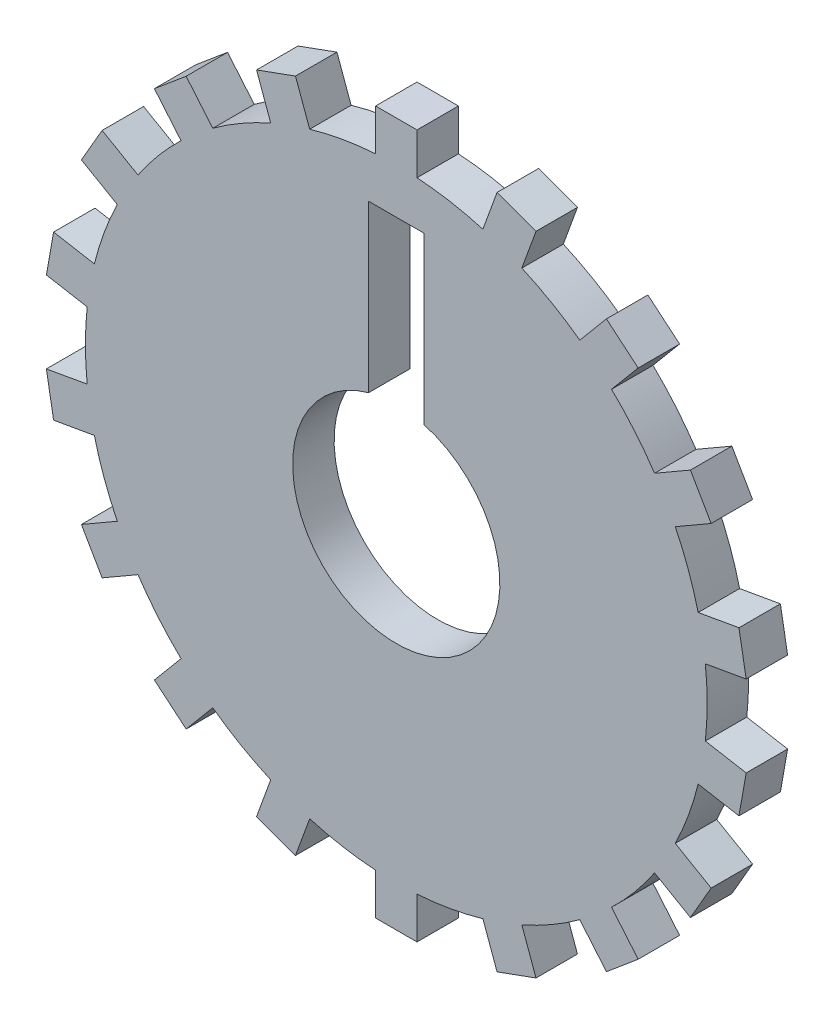
from build123d import *

# Parameters (mm, degrees)
BOSS_EXTRUDE1_DEPTH = 1.5
BOSS_EXTRUDE2_DEPTH = 1.5
CIRPATTERN1_COUNT   = 18


with BuildPart() as part:
    # Sketch1 → Boss-Extrude1 (new, symmetric)
    with BuildSketch(Plane.XY):
        with BuildLine():
            ThreePointArc((1.5, 22.449944321), (0, 22.5), (-1.5, 22.449944321))
            ThreePointArc((-1.5, 22.449944321), (-15.370426149, -16.431676725), (22.5, 0))
            ThreePointArc((22.5, 0), (16.431676725, 15.370426149), (1.5, 22.449944321))
        make_face()
        with BuildLine():
            ThreePointArc((7.5, 0), (-4.541475531, -5.968668193), (-2, 7.228416147))
            Line((-2, 7.228416147), (-2, 19.228416147))
            Line((-2, 19.228416147), (2, 19.228416147))
            Line((2, 19.228416147), (2, 7.228416147))
            ThreePointArc((2, 7.228416147), (5.968668193, 4.541475531), (7.5, 0))
        make_face(mode=Mode.SUBTRACT)
    extrude(amount=BOSS_EXTRUDE1_DEPTH, both=True)

    # Sketch1<3> → Boss-Extrude2 (add, symmetric)
    with BuildSketch(Plane.XY):
        with BuildLine():
            Line((-1.5, 25.449944321), (-1.5, 22.449944321))
            ThreePointArc((-1.5, 22.449944321), (0, 22.5), (1.5, 22.449944321))
            Line((1.5, 22.449944321), (1.5, 25.449944321))
            Line((1.5, 25.449944321), (-1.5, 25.449944321))
        make_face()
    boss_extrude2 = extrude(amount=BOSS_EXTRUDE2_DEPTH, both=True)

    # CirPattern1: Boss-Extrude2 ×18 about axis
    cirpattern1_axis = Axis((0, 0, 13.219379373), (0, 0, -1))
    for i in range(1, CIRPATTERN1_COUNT):
        add(boss_extrude2.rotate(cirpattern1_axis, i * 360 / CIRPATTERN1_COUNT))


solid = part.part
